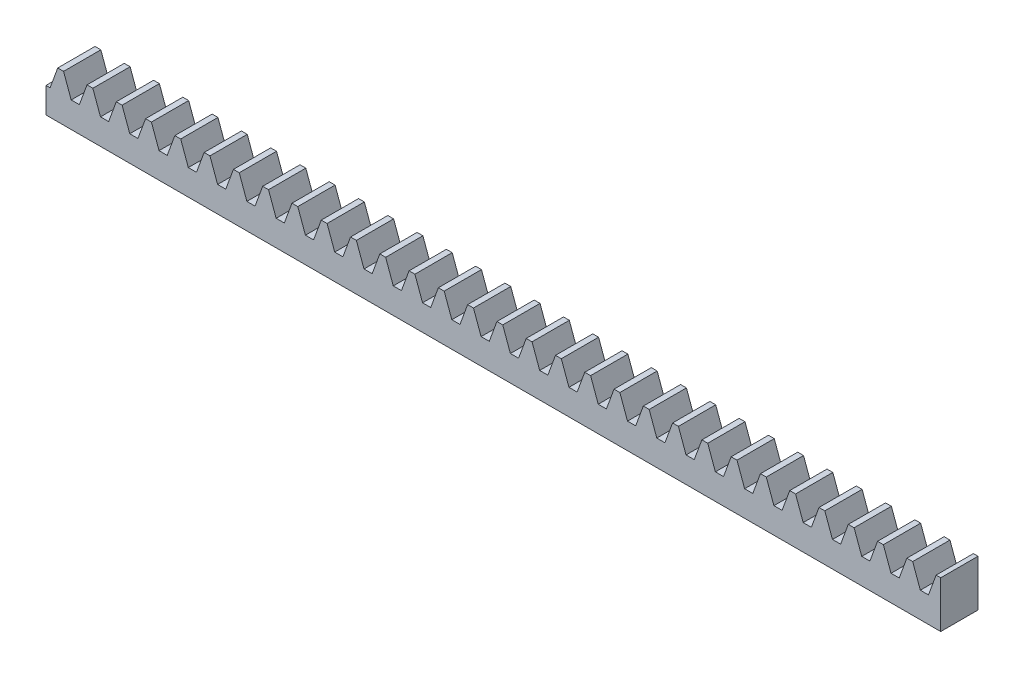
from build123d import *

# Parameters (mm, degrees)
BLANKSKE_W        = 609.6
BLANKSKE_H        = 31.75
BLANK_DEPTH       = 25.4
TOOTHCUTSIM_DEPTH = 611.954484802
TEETHCUTS_COUNT   = 31
TEETHCUTS_PITCH   = 19.949113328


with BuildPart() as part:
    # BlankSke → Blank (new body)
    with BuildSketch(Plane.XY):
        with Locations((304.8, 15.875)):
            Rectangle(BLANKSKE_W, BLANKSKE_H)
    extrude(amount=-BLANK_DEPTH)

    # TooCutSkeSim → ToothCutSim (cut, through all)
    with BuildSketch(Plane.XY):
        Polygon((2.784064597, 17.4625), (-2.784064597, 17.4625), (-7.993534163, 31.7754), (7.993534163, 31.7754), align=None)
    toothcutsim = extrude(amount=-TOOTHCUTSIM_DEPTH, mode=Mode.SUBTRACT)

    # TeethCuts: ToothCutSim ×31
    with Locations(*[(i * TEETHCUTS_PITCH, 0, 0) for i in range(1, TEETHCUTS_COUNT)]):
        add(toothcutsim, mode=Mode.SUBTRACT)


solid = part.part
